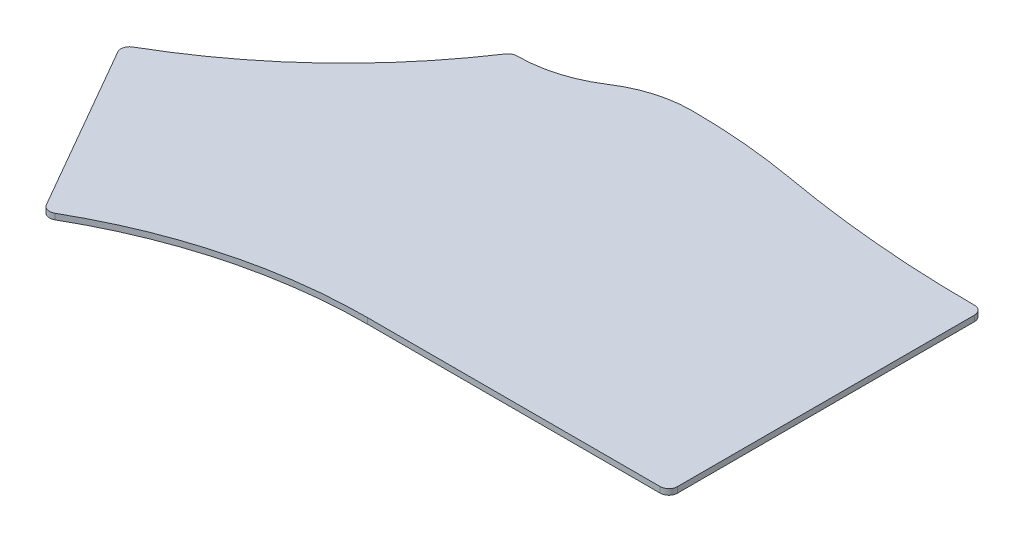
from build123d import *

# Parameters (mm, degrees)
BOSS_EXTRUDE1_DEPTH = 2


with BuildPart() as part:
    # Sketch3 → Boss-Extrude1 (new body)
    with BuildSketch(Plane(origin=(0, 0, 0), x_dir=(1, 0, 0), z_dir=(0, 1, 0))):
        with BuildLine():
            Line((158, 22.5), (158, -81))
            ThreePointArc((158, -81), (157.121320344, -83.121320344), (155, -84))
            Line((155, -84), (53.050466482, -84))
            ThreePointArc((53.050466482, -84), (8.545143105, -89.838724048), (-32.948056713, -106.959730921))
            ThreePointArc((-32.948056713, -106.959730921), (-35.225053269, -107.255305993), (-37.044136112, -105.854229426))
            Line((-37.044136112, -105.854229426), (-70.68813753, -47.336444363))
            ThreePointArc((-70.68813753, -47.336444363), (-70.983712602, -45.059447807), (-69.582636034, -43.240364964))
            ThreePointArc((-69.582636034, -43.240364964), (-32.385273168, -15.689281312), (-2.499253861, 19.659436693))
            ThreePointArc((-2.499253861, 19.659436693), (-1.418042651, 20.643701012), (0, 21))
            ThreePointArc((0, 21), (12.831153008, 22.8704149), (24.594386694, 28.325987526))
            ThreePointArc((24.594386694, 28.325987526), (35.310753338, 33.296042365), (47, 35))
            ThreePointArc((47, 35), (65.898115208, 34.170434491), (84.650849693, 31.688119703))
            ThreePointArc((84.650849693, 31.688119703), (119.689605729, 27.050010933), (155, 25.5))
            ThreePointArc((155, 25.5), (157.121320344, 24.621320344), (158, 22.5))
        make_face()
    extrude(amount=-BOSS_EXTRUDE1_DEPTH)


solid = part.part
